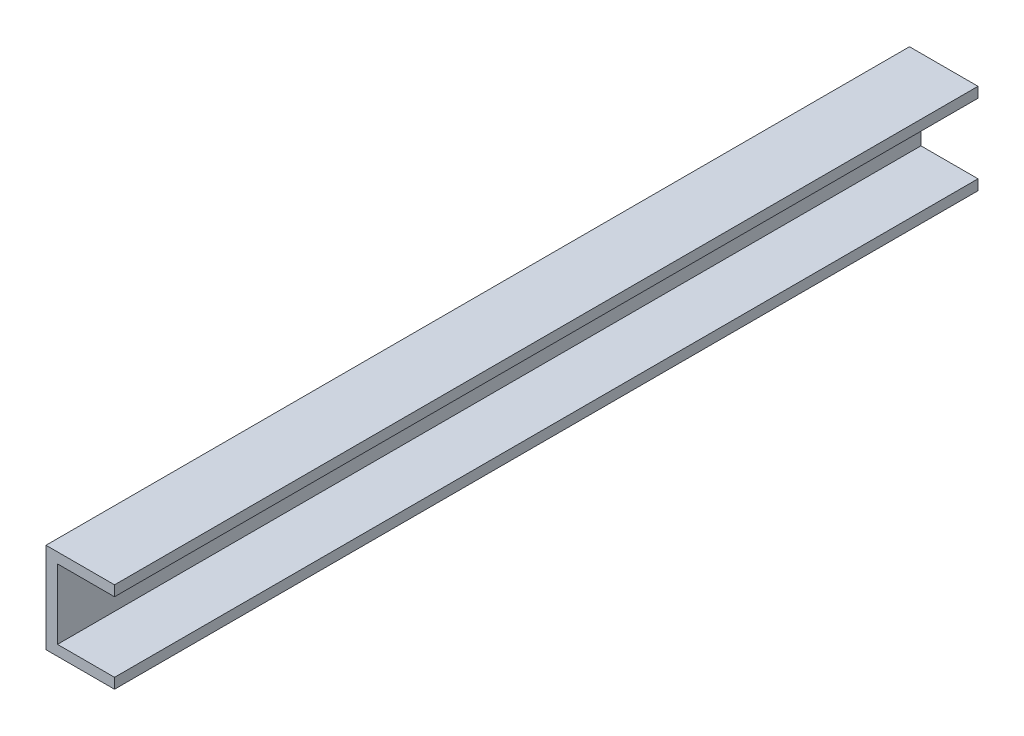
from build123d import *

# Parameters (mm, degrees)
BOSS_EXTRUDE1_DEPTH = 668.02


with BuildPart() as part:
    # Sketch1 → Boss-Extrude1 (new body)
    with BuildSketch(Plane.XY):
        Polygon((0, 35), (0, -35), (53.017157285, -35), (53.017157285, -26.974522293), (8.877029896, -26.974522293), (8.877029896, 26.974522293), (53.017157285, 26.974522293), (53.017157285, 35), align=None)
    extrude(amount=BOSS_EXTRUDE1_DEPTH)


solid = part.part
